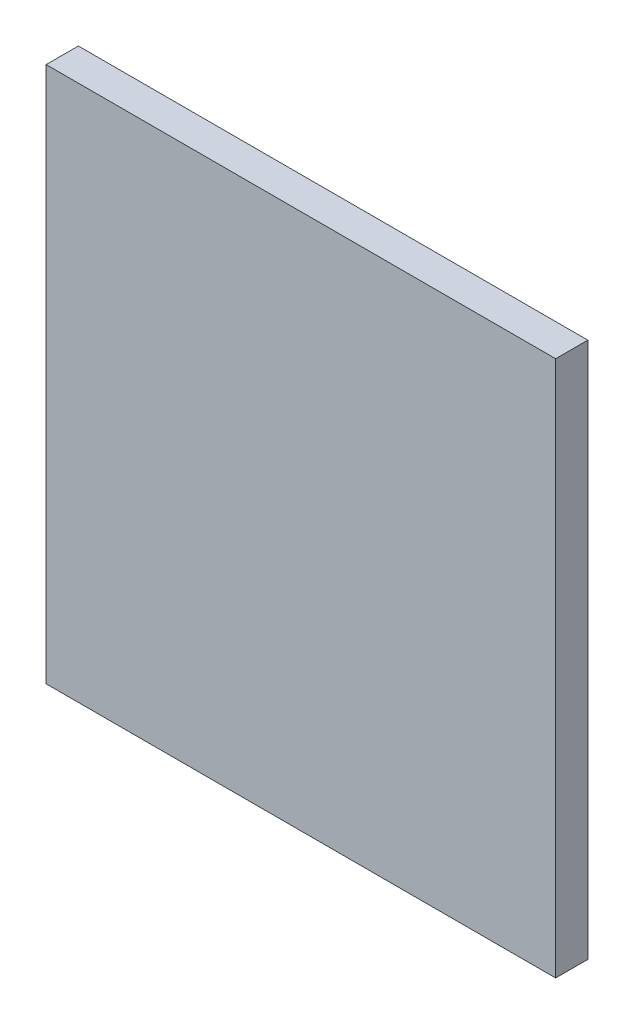
from build123d import *

# Parameters (mm, degrees)
SKETCH_1_W      = 19
SKETCH_1_H      = 20
EXTRUDE_1_DEPTH = 1.2


with BuildPart() as part:
    # ｽｹｯﾁ1 → ﾎﾞｽ - 押し出し1 (new body)
    with BuildSketch(Plane.XY):
        Rectangle(SKETCH_1_W, SKETCH_1_H)
    extrude(amount=EXTRUDE_1_DEPTH)


solid = part.part
